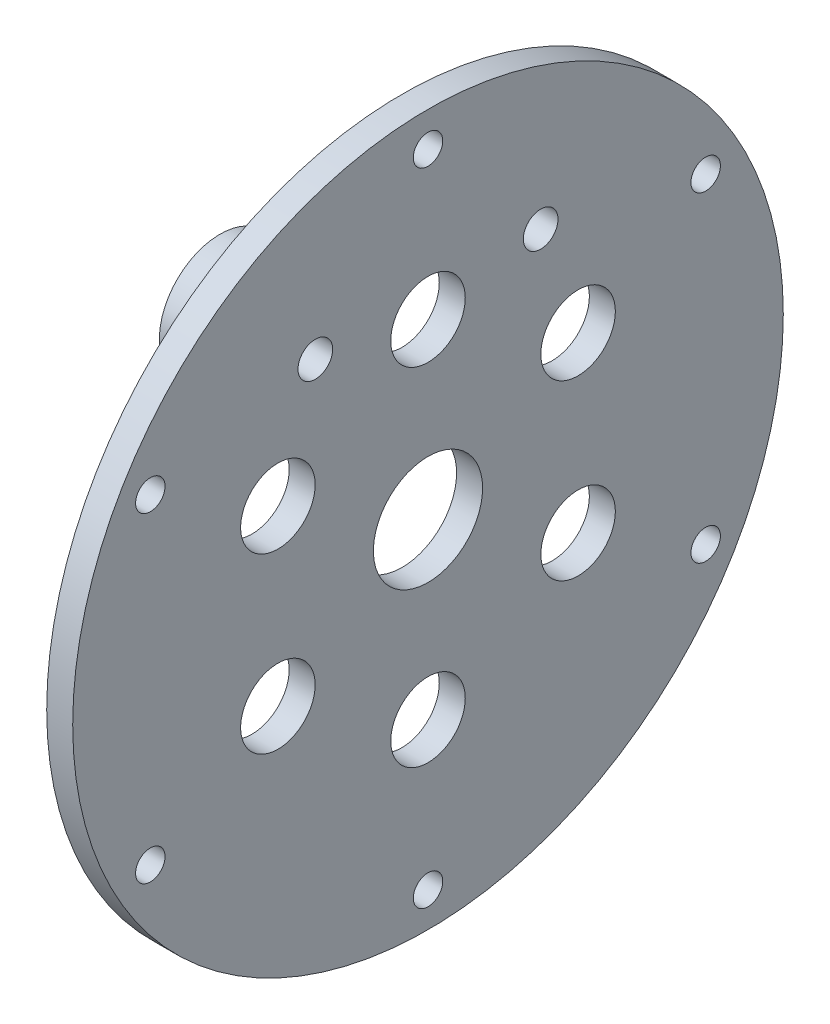
from build123d import *

# Parameters (mm, degrees)
AXIAL_BLANK_PROFILE_W                          = 3
AXIAL_BLANK_PROFILE_H                          = 41
RELOCATED_START                                = -11
RELOCATED_INTEGRAL_PORT_BOSSES_BETWE_2_R       = 7
RELOCATED_INTEGRAL_PORT_BOSSES_BETWEEN_M_DEPTH = 8
SEVEN_START                                    = -3
SEVEN_DRY_MAGNET_PASSAGES_THROUGH_CO_2_R       = 6.3
SEVEN_DRY_MAGNET_PASSAGES_THROUGH_CO_2_R_2     = 4.3
SEVEN_DRY_MAGNET_PASSAGES_THROUGH_COVER_DEPTH  = 3
SIX_START                                      = -3
SIX_COVER_CLEARANCE_HOLES_PCD74_SKETCH_R       = 1.7
SIX_COVER_CLEARANCE_HOLES_PCD74_DEPTH          = 3
G1_8_START                                     = -11
G1_8_TAPPING_PILOT_ENVELOPES_DEPTH7_SKET_R     = 4.4
G1_8_TAPPING_PILOT_ENVELOPES_DEPTH7_DEPTH      = 7
WATER_START                                    = -11
WATER_PORTS_DIAMETER4_INTO_COOLANT_P_2_R       = 2
WATER_PORTS_DIAMETER4_INTO_COOLANT_PLENU_DEPTH = 11


with BuildPart() as part:
    # Axial blank profile → Native revolved blank (revolve)
    with BuildSketch(Plane.XY, mode=Mode.PRIVATE) as native_revolved_blank_sk:
        with Locations((-1.5, 20.5)):
            Rectangle(AXIAL_BLANK_PROFILE_W, AXIAL_BLANK_PROFILE_H)
    revolve(native_revolved_blank_sk.sketch.rotate(Axis((-60, 0, 0), (1, 0, 0)), 90), axis=Axis((-60, 0, 0), (1, 0, 0)))

    # Relocated integral port bosses betwe 2 → Relocated integral port bosses between m (add)
    with BuildSketch(Plane(origin=(0, 0, 0), x_dir=(0, 0, -1), z_dir=(1, 0, 0)).offset(RELOCATED_START)):
        with Locations((-13, 22.516660498)):
            Circle(RELOCATED_INTEGRAL_PORT_BOSSES_BETWE_2_R)
        with Locations((13, 22.516660498)):
            Circle(RELOCATED_INTEGRAL_PORT_BOSSES_BETWE_2_R)
    extrude(amount=RELOCATED_INTEGRAL_PORT_BOSSES_BETWEEN_M_DEPTH)

    # Seven dry magnet passages through co 2 → Seven dry magnet passages through cover (cut)
    with BuildSketch(Plane(origin=(0, 0, 0), x_dir=(0, 0, -1), z_dir=(1, 0, 0)).offset(SEVEN_START)):
        Circle(SEVEN_DRY_MAGNET_PASSAGES_THROUGH_CO_2_R)
        with Locations((0, 20)):
            Circle(SEVEN_DRY_MAGNET_PASSAGES_THROUGH_CO_2_R_2)
        with Locations((-17.320508076, 10)):
            Circle(SEVEN_DRY_MAGNET_PASSAGES_THROUGH_CO_2_R_2)
        with Locations((-17.320508076, -10)):
            Circle(SEVEN_DRY_MAGNET_PASSAGES_THROUGH_CO_2_R_2)
        with Locations((0, -20)):
            Circle(SEVEN_DRY_MAGNET_PASSAGES_THROUGH_CO_2_R_2)
        with Locations((17.320508076, -10)):
            Circle(SEVEN_DRY_MAGNET_PASSAGES_THROUGH_CO_2_R_2)
        with Locations((17.320508076, 10)):
            Circle(SEVEN_DRY_MAGNET_PASSAGES_THROUGH_CO_2_R_2)
    extrude(amount=SEVEN_DRY_MAGNET_PASSAGES_THROUGH_COVER_DEPTH, mode=Mode.SUBTRACT)

    # Six cover clearance holes PCD74 sketch → Six cover clearance holes PCD74 (cut)
    with BuildSketch(Plane(origin=(0, 0, 0), x_dir=(0, 0, -1), z_dir=(1, 0, 0)).offset(SIX_START)):
        with Locations((0, 37)):
            Circle(SIX_COVER_CLEARANCE_HOLES_PCD74_SKETCH_R)
        with Locations((-32.04293994, 18.5)):
            Circle(SIX_COVER_CLEARANCE_HOLES_PCD74_SKETCH_R)
        with Locations((-32.04293994, -18.5)):
            Circle(SIX_COVER_CLEARANCE_HOLES_PCD74_SKETCH_R)
        with Locations((0, -37)):
            Circle(SIX_COVER_CLEARANCE_HOLES_PCD74_SKETCH_R)
        with Locations((32.04293994, -18.5)):
            Circle(SIX_COVER_CLEARANCE_HOLES_PCD74_SKETCH_R)
        with Locations((32.04293994, 18.5)):
            Circle(SIX_COVER_CLEARANCE_HOLES_PCD74_SKETCH_R)
    extrude(amount=SIX_COVER_CLEARANCE_HOLES_PCD74_DEPTH, mode=Mode.SUBTRACT)

    # G1-8 tapping pilot envelopes depth7 sketch → G1-8 tapping pilot envelopes depth7 (cut)
    with BuildSketch(Plane(origin=(0, 0, 0), x_dir=(0, 0, -1), z_dir=(1, 0, 0)).offset(G1_8_START)):
        with Locations((-13, 22.516660498)):
            Circle(G1_8_TAPPING_PILOT_ENVELOPES_DEPTH7_SKET_R)
        with Locations((13, 22.516660498)):
            Circle(G1_8_TAPPING_PILOT_ENVELOPES_DEPTH7_SKET_R)
    extrude(amount=G1_8_TAPPING_PILOT_ENVELOPES_DEPTH7_DEPTH, mode=Mode.SUBTRACT)

    # Water ports diameter4 into coolant p 2 → Water ports diameter4 into coolant plenu (cut)
    with BuildSketch(Plane(origin=(0, 0, 0), x_dir=(0, 0, -1), z_dir=(1, 0, 0)).offset(WATER_START)):
        with Locations((-13, 22.516660498)):
            Circle(WATER_PORTS_DIAMETER4_INTO_COOLANT_P_2_R)
        with Locations((13, 22.516660498)):
            Circle(WATER_PORTS_DIAMETER4_INTO_COOLANT_P_2_R)
    extrude(amount=WATER_PORTS_DIAMETER4_INTO_COOLANT_PLENU_DEPTH, mode=Mode.SUBTRACT)


solid = part.part
